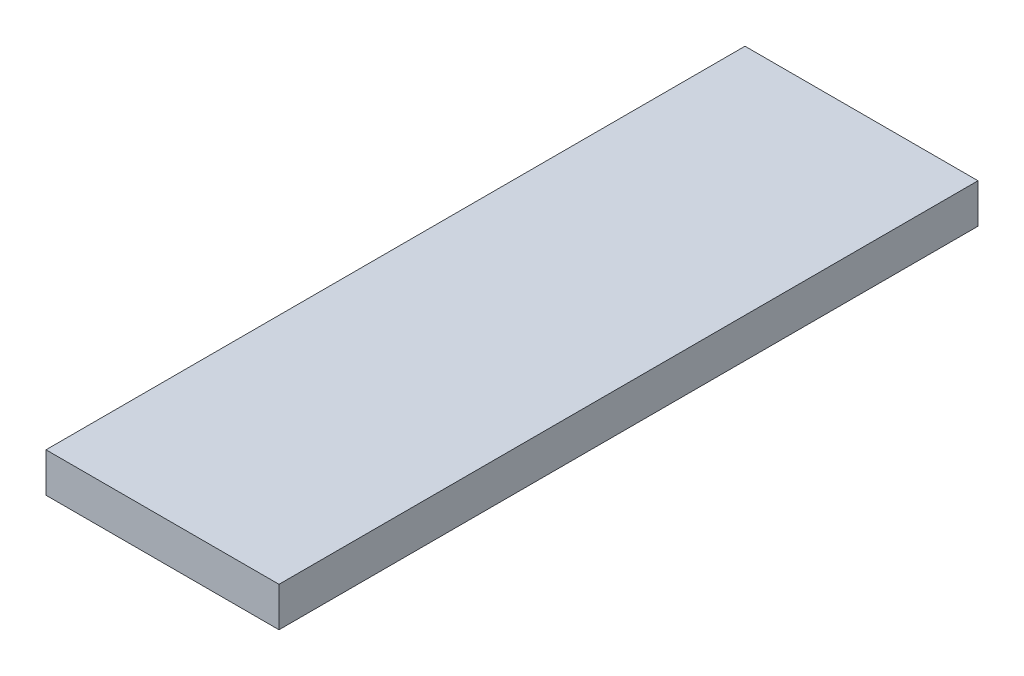
from build123d import *

# Parameters (mm, degrees)
SKETCH1_W           = 55
SKETCH1_H           = 165
BOSS_EXTRUDE1_DEPTH = 9.3


with BuildPart() as part:
    # Sketch1 → Boss-Extrude1 (new body)
    with BuildSketch(Plane(origin=(0, 0, 0), x_dir=(1, 0, 0), z_dir=(0, 1, 0))):
        with Locations((27.5, 82.5)):
            Rectangle(SKETCH1_W, SKETCH1_H)
    extrude(amount=BOSS_EXTRUDE1_DEPTH)


solid = part.part
